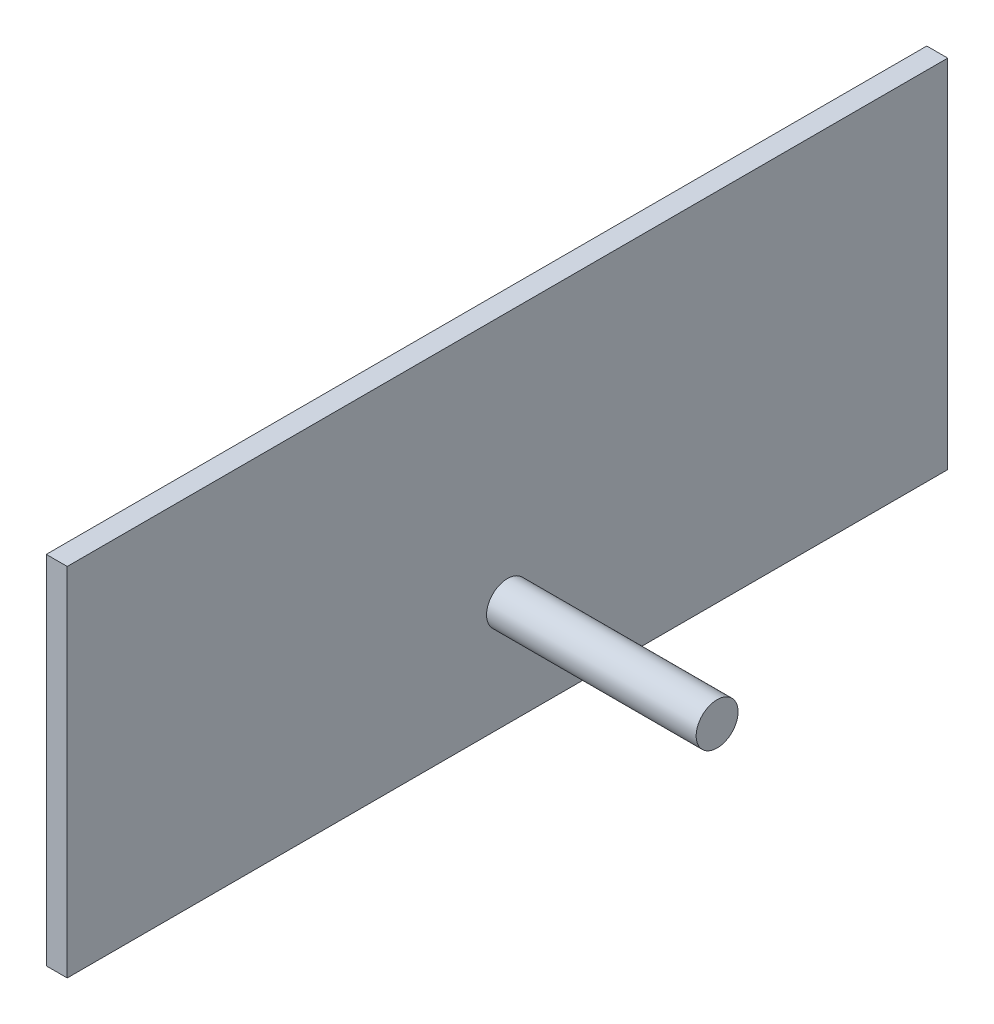
from build123d import *

# Parameters (mm, degrees)
BOSS_EXTRUDE1_DEPTH      = 50
BOSS_EXTRUDE1_DEPTH_BACK = 5
SKETCH1_R                = 5
SKETCH1_3_R              = 5
BOSS_EXTRUDE2_DEPTH      = 5


with BuildPart() as part:
    # Sketch1 → Boss-Extrude1 (new, two sides: drawn at the far end of the back side and taken through both)
    with BuildSketch(Plane(origin=(0, 0, 0), x_dir=(0, 0, -1), z_dir=(1, 0, 0)).offset(-BOSS_EXTRUDE1_DEPTH_BACK)):
        Circle(SKETCH1_R)
    extrude(amount=BOSS_EXTRUDE1_DEPTH + BOSS_EXTRUDE1_DEPTH_BACK)


with BuildPart() as body_2:
    # Sketch1<3> → Boss-Extrude2 (new body)
    with BuildSketch(Plane(origin=(0, 0, 0), x_dir=(0, 0, -1), z_dir=(1, 0, 0))):
        Polygon((0, -25), (105, -25), (105, 0), (105, 60), (0, 60), (-105, 60), (-105, 0), (-105, -25), align=None)
        Circle(SKETCH1_3_R, mode=Mode.SUBTRACT)
    extrude(amount=-BOSS_EXTRUDE2_DEPTH)


solid = Compound([part.part, body_2.part])
